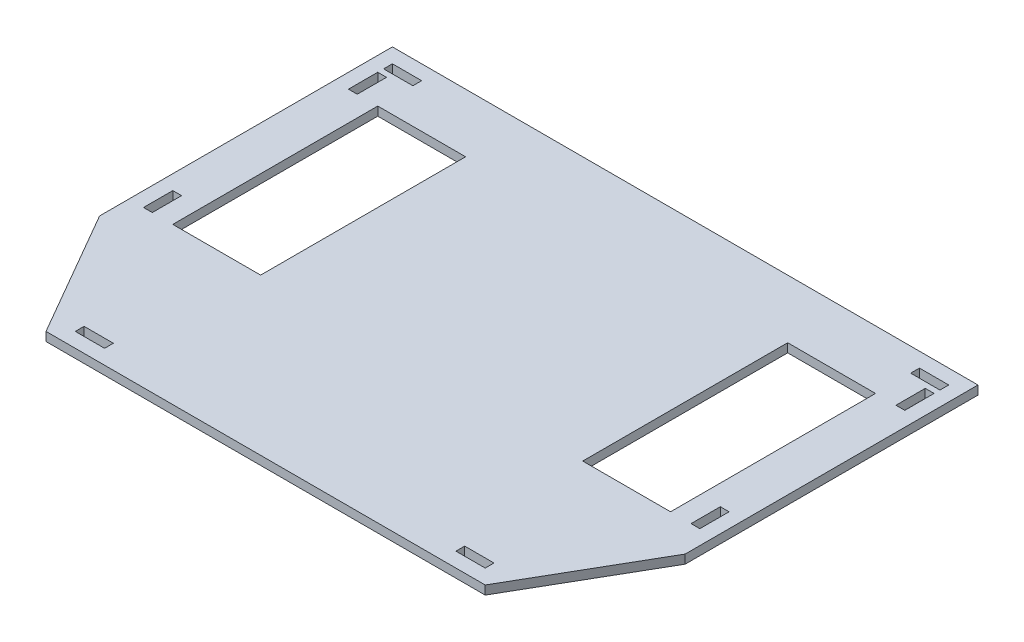
from build123d import *

# Parameters (mm, degrees)
RESSALTO_EXTRUS_O1_DEPTH = 3
ESBO_O3_W                = 10
ESBO_O3_H                = 3
ESBO_O3_W_2              = 3
ESBO_O3_H_2              = 10
ESBO_O3_W_3              = 3.017337907
CORTE_EXTRUS_O1_DEPTH    = 3
ESBO_O4_W                = 30
ESBO_O4_H                = 70
CORTE_EXTRUS_O2_DEPTH    = 3


with BuildPart() as part:
    # Esboço1 → Ressalto-extrusão1 (new body)
    with BuildSketch(Plane(origin=(0, 0, 0), x_dir=(1, 0, 0), z_dir=(0, 1, 0))):
        Polygon((-97.357643635, -26.698729811), (-97.357643635, 73.301270189), (102.642356365, 73.301270189), (102.642356365, -26.698729811), (77.642356365, -70), (-72.357643635, -70), align=None)
    extrude(amount=RESSALTO_EXTRUS_O1_DEPTH)

    # Esboço3 → Corte-extrusão1 (cut)
    with BuildSketch(Plane(origin=(0, 3, 0), x_dir=(1, 0, 0), z_dir=(0, 1, 0))):
        with Locations((-62.357643635, -63.5)):
            Rectangle(ESBO_O3_W, ESBO_O3_H)
        with Locations((67.642356365, -63.5)):
            Rectangle(ESBO_O3_W, ESBO_O3_H)
        with Locations((96.142356365, -11.698729811)):
            Rectangle(ESBO_O3_W_2, ESBO_O3_H_2)
        with Locations((96.133687412, 58.301270189)):
            Rectangle(ESBO_O3_W_3, ESBO_O3_H_2)
        with Locations((92.642356365, 66.801270189)):
            Rectangle(ESBO_O3_W, ESBO_O3_H)
        with Locations((-90.857643635, -11.698729811)):
            Rectangle(ESBO_O3_W_2, ESBO_O3_H_2)
        with Locations((-90.857643635, 58.301270189)):
            Rectangle(ESBO_O3_W_2, ESBO_O3_H_2)
        with Locations((-87.357643635, 66.801270189)):
            Rectangle(ESBO_O3_W, ESBO_O3_H)
    extrude(amount=-CORTE_EXTRUS_O1_DEPTH, mode=Mode.SUBTRACT)

    # Esboço4 → Corte-extrusão2 (cut)
    with BuildSketch(Plane(origin=(0, 3, 0), x_dir=(1, 0, 0), z_dir=(0, 1, 0))):
        with Locations((-67.357643635, 18.301270189)):
            Rectangle(ESBO_O4_W, ESBO_O4_H)
        with Locations((72.642356365, 18.301270189)):
            Rectangle(ESBO_O4_W, ESBO_O4_H)
    extrude(amount=-CORTE_EXTRUS_O2_DEPTH, mode=Mode.SUBTRACT)


solid = part.part
